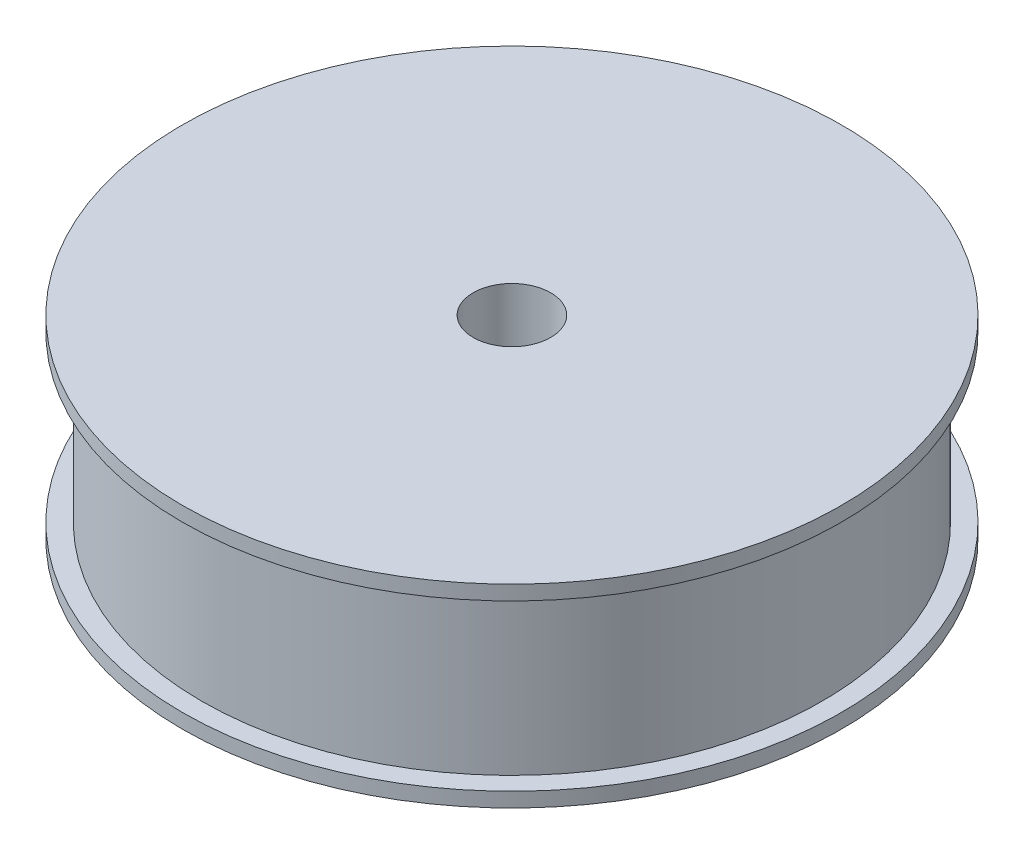
from build123d import *


with BuildPart() as part:
    # Sketch1 → Revolve1 (revolve)
    with BuildSketch(Plane(origin=(0, 0, 0), x_dir=(0, 0, -1), z_dir=(1, 0, 0)), mode=Mode.PRIVATE) as revolve1_sk:
        Polygon((32, -8.5), (32, 8.5), (34, 8.5), (34, 10), (4, 10), (4, -10), (34, -10), (34, -8.5), align=None)
    revolve(revolve1_sk.sketch.rotate(Axis((0, 10.31552251, 0), (0, -1, 0)), 180), axis=Axis((0, 10.31552251, 0), (0, -1, 0)))


solid = part.part
